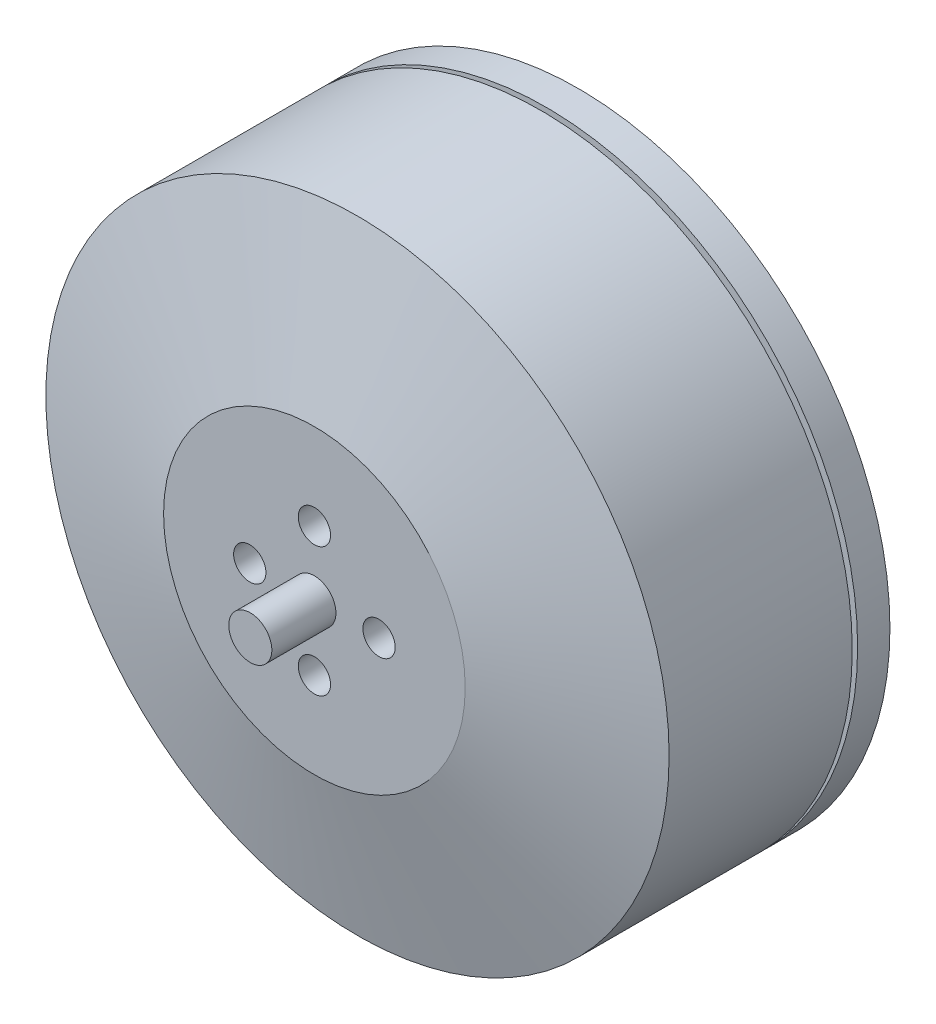
from build123d import *

# Parameters (mm, degrees)
SKETCH4_R           = 2
BOSS_EXTRUDE1_DEPTH = 5.95
SKETCH5_R           = 1.5
CUT_EXTRUDE1_DEPTH  = 5
SKETCH6_R           = 1.5
CUT_EXTRUDE2_DEPTH  = 5
SKETCH7_R           = 4.25
BOSS_EXTRUDE2_DEPTH = 4.3
SKETCH8_R           = 2.8
CUT_EXTRUDE3_DEPTH  = 0.1
CUT_EXTRUDE4_DEPTH  = 1.5
SKETCH10_R          = 6.5
SKETCH10_R_2        = 5.5
CUT_EXTRUDE5_DEPTH  = 0.1


with BuildPart() as part:
    # Sketch3 → Revolve1 (revolve)
    with BuildSketch(Plane(origin=(0, 0, 0), x_dir=(0, 0, -1), z_dir=(1, 0, 0)), mode=Mode.PRIVATE) as revolve1_sk:
        Polygon((-29.5, 0), (-29.5, 14), (-25.5, 28.93), (-8.5, 28.93), (-8.5, 26.93), (-8, 26.93), (-8, 28.93), (-5, 28.93), (0, 17.75), (0, 9), (-1.5, 7.5), (-1.5, 0), align=None)
    revolve(revolve1_sk.sketch.rotate(Axis((0, 0, 66.283384922), (0, 0, -1)), 90), axis=Axis((0, 0, 66.283384922), (0, 0, -1)))

    # Sketch4 → Boss-Extrude1 (add)
    with BuildSketch(Plane.XY.offset(29.5)):
        with Locations(Location((0, 0, 0), (0, 0, 180))):
            Circle(SKETCH4_R)
    extrude(amount=BOSS_EXTRUDE1_DEPTH)

    # Sketch5 → Cut-Extrude1 (cut)
    with BuildSketch(Plane.XY.offset(29.5)):
        with Locations((0, 6)):
            Circle(SKETCH5_R)
        with Locations((6, 0)):
            Circle(SKETCH5_R)
        with Locations((0, -6)):
            Circle(SKETCH5_R)
        with Locations((-6, 0)):
            Circle(SKETCH5_R)
    extrude(amount=-CUT_EXTRUDE1_DEPTH, mode=Mode.SUBTRACT)

    # Sketch6 → Cut-Extrude2 (cut)
    with BuildSketch(Plane(origin=(0, 0, 0), x_dir=(-1, 0, 0), z_dir=(0, 0, -1))):
        with Locations((0, 12.5)):
            Circle(SKETCH6_R)
        with Locations((12.5, 0)):
            Circle(SKETCH6_R)
        with Locations((0, -12.5)):
            Circle(SKETCH6_R)
        with Locations((-12.5, 0)):
            Circle(SKETCH6_R)
    extrude(amount=-CUT_EXTRUDE2_DEPTH, mode=Mode.SUBTRACT)

    # Sketch7 → Boss-Extrude2 (add)
    with BuildSketch(Plane(origin=(0, 0, 1.5), x_dir=(-1, 0, 0), z_dir=(0, 0, -1))):
        with Locations(Location((0, 0, 0), (0, 0, 180))):
            Circle(SKETCH7_R)
    extrude(amount=BOSS_EXTRUDE2_DEPTH)

    # Sketch8 → Cut-Extrude3 (cut)
    with BuildSketch(Plane(origin=(0, 0, -2.8), x_dir=(-1, 0, 0), z_dir=(0, 0, -1))):
        Circle(SKETCH8_R)
    extrude(amount=-CUT_EXTRUDE3_DEPTH, mode=Mode.SUBTRACT)

    # Sketch9 → Cut-Extrude4 (cut)
    with BuildSketch(Plane(origin=(0, 0, -2.7), x_dir=(-1, 0, 0), z_dir=(0, 0, -1))):
        Polygon((0, -1.154700538), (1, -0.577350269), (1, 0.577350269), (0, 1.154700538), (-1, 0.577350269), (-1, -0.577350269), align=None)
    extrude(amount=-CUT_EXTRUDE4_DEPTH, mode=Mode.SUBTRACT)

    # Sketch10 → Cut-Extrude5 (cut)
    with BuildSketch(Plane(origin=(0, 0, 1.5), x_dir=(-1, 0, 0), z_dir=(0, 0, -1))):
        Circle(SKETCH10_R)
        Circle(SKETCH10_R_2, mode=Mode.SUBTRACT)
    extrude(amount=-CUT_EXTRUDE5_DEPTH, mode=Mode.SUBTRACT)


solid = part.part
